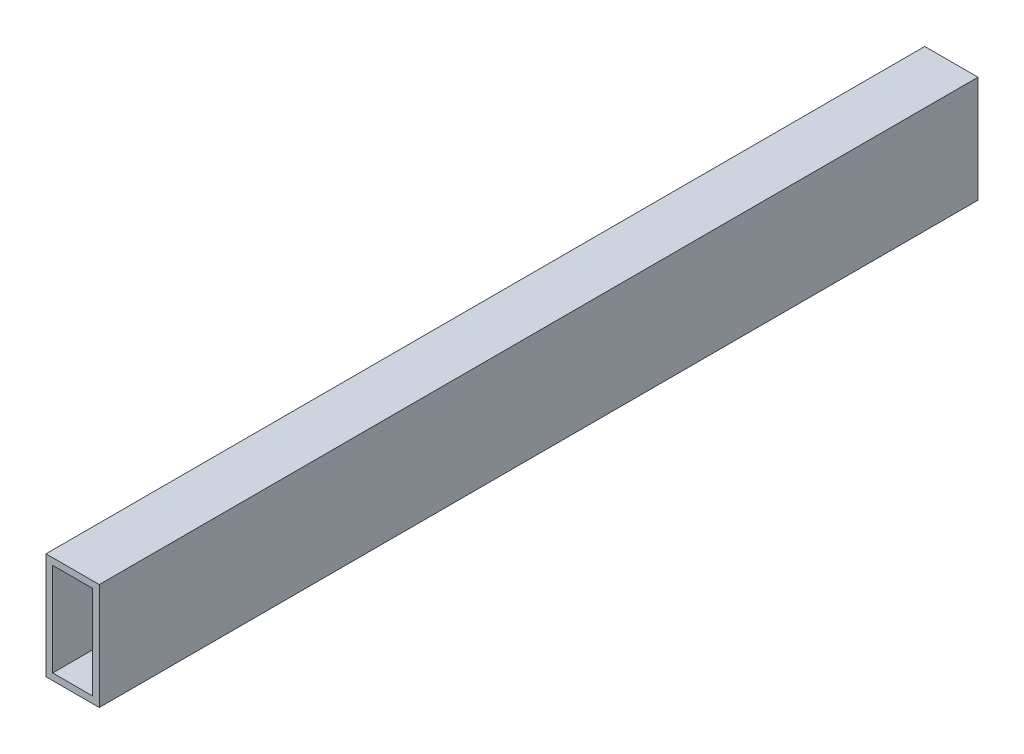
from build123d import *

# Parameters (mm, degrees)
SKETCH1_W           = 25.4
SKETCH1_H           = 50.8
SKETCH1_W_2         = 19.05
SKETCH1_H_2         = 44.45
BOSS_EXTRUDE1_DEPTH = 419.1


with BuildPart() as part:
    # Sketch1 → Boss-Extrude1 (new body)
    with BuildSketch(Plane.XY):
        Rectangle(SKETCH1_W, SKETCH1_H)
        Rectangle(SKETCH1_W_2, SKETCH1_H_2, mode=Mode.SUBTRACT)
    extrude(amount=BOSS_EXTRUDE1_DEPTH)


solid = part.part
